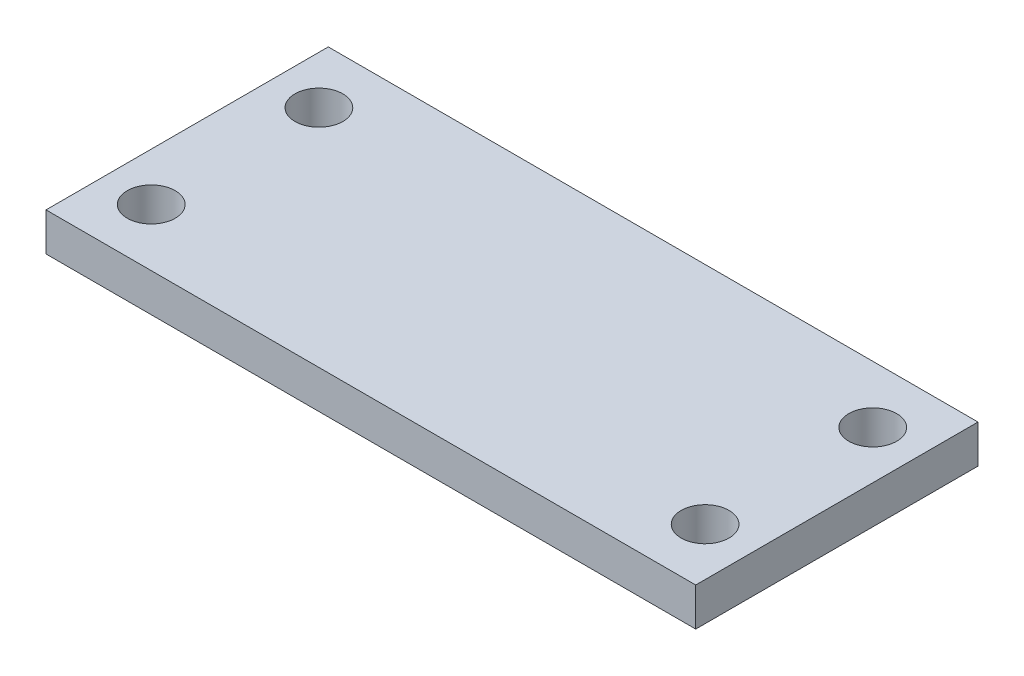
from build123d import *

# Parameters (mm, degrees)
SKETCH1_W           = 67.818
SKETCH1_H           = 29.464
SKETCH1_R           = 2.5019
BOSS_EXTRUDE1_DEPTH = 3.9878


with BuildPart() as part:
    # Sketch1 → Boss-Extrude1 (new body)
    with BuildSketch(Plane(origin=(0, 0, 0), x_dir=(1, 0, 0), z_dir=(0, 1, 0))):
        with Locations((33.909, 14.732)):
            Rectangle(SKETCH1_W, SKETCH1_H)
        with Locations(Location((5.0038, 23.4823, 0), (0, 0, 270))):
            Circle(SKETCH1_R, mode=Mode.SUBTRACT)
        with Locations(Location((62.8142, 23.4823, 0), (0, 0, 90))):
            Circle(SKETCH1_R, mode=Mode.SUBTRACT)
        with Locations(Location((62.8142, 5.9817, 0), (0, 0, 270))):
            Circle(SKETCH1_R, mode=Mode.SUBTRACT)
        with Locations(Location((5.0038, 5.9817, 0), (0, 0, 90))):
            Circle(SKETCH1_R, mode=Mode.SUBTRACT)
    extrude(amount=BOSS_EXTRUDE1_DEPTH)


solid = part.part
